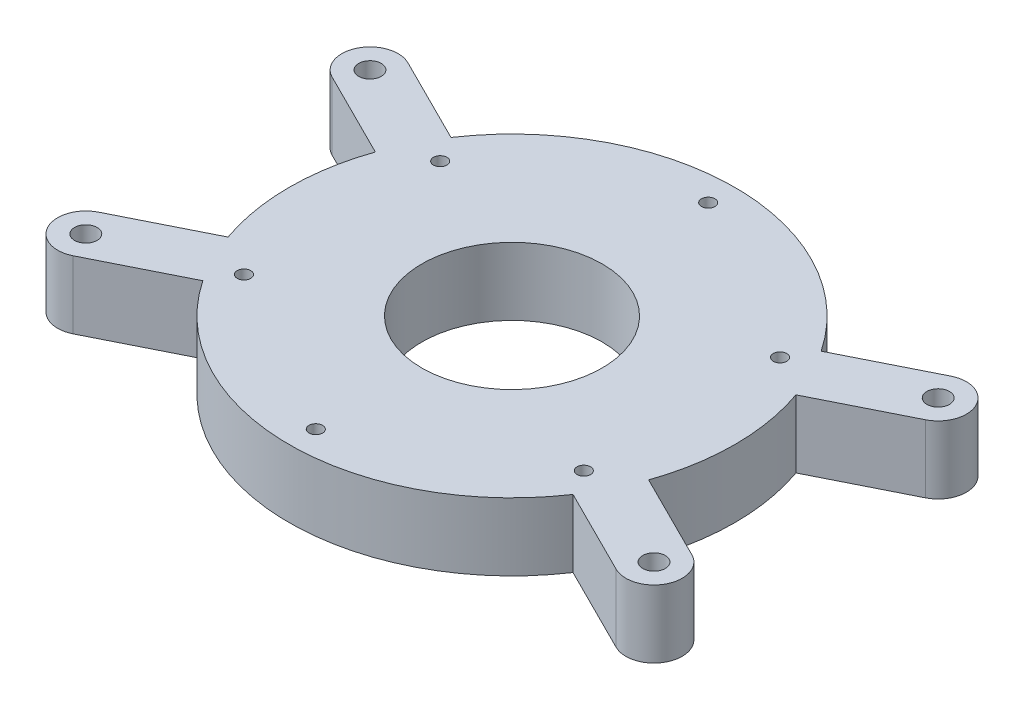
from build123d import *

# Parameters (mm, degrees)
SKETCH_1_R               = 20
EXTRUDE_1_DEPTH          = 15
SKETCH_2_R               = 2.5
CUT_EXTRUDE_1_DEPTH      = 10
MIRROR_2_COPY_1_SKETCH_R = 2.5
MIRROR_2_COPY_1_DEPTH    = 10
SKETCH_3_R               = 2.5
CUT_EXTRUDE_2_DEPTH      = 10
MIRROR_4_COPY_1_SKETCH_R = 2.5
MIRROR_4_COPY_1_DEPTH    = 10
SKETCH_4_R               = 1.5
CUT_EXTRUDE_3_DEPTH      = 87.365727496
PATTERN_CIRCULAR_1_COUNT = 6


with BuildPart() as part:
    # 草图1 → 凸台-拉伸1 (new body)
    with BuildSketch(Plane(origin=(0, 0, 0), x_dir=(1, 0, 0), z_dir=(0, 1, 0))):
        with BuildLine():
            Line((46.623322285, 16.328680875), (65.781966365, 25.910071498))
            ThreePointArc((65.781966365, 25.910071498), (68.576327064, 34.295567803), (60.190830759, 37.089928502))
            Line((60.190830759, 37.089928502), (41.03218668, 27.50853788))
            ThreePointArc((41.03218668, 27.50853788), (0, 49.4), (-41.03218668, 27.50853788))
            Line((-41.03218668, 27.50853788), (-60.190830759, 37.089928502))
            ThreePointArc((-60.190830759, 37.089928502), (-68.576327064, 34.295567803), (-65.781966365, 25.910071498))
            Line((-65.781966365, 25.910071498), (-46.623322285, 16.328680875))
            ThreePointArc((-46.623322285, 16.328680875), (-49.4, 0), (-46.623322285, -16.328680875))
            Line((-46.623322285, -16.328680875), (-65.781966365, -25.910071498))
            ThreePointArc((-65.781966365, -25.910071498), (-68.576327064, -34.295567803), (-60.190830759, -37.089928502))
            Line((-60.190830759, -37.089928502), (-41.03218668, -27.50853788))
            ThreePointArc((-41.03218668, -27.50853788), (0, -49.4), (41.03218668, -27.50853788))
            Line((41.03218668, -27.50853788), (60.190830759, -37.089928502))
            ThreePointArc((60.190830759, -37.089928502), (68.576327064, -34.295567803), (65.781966365, -25.910071498))
            Line((65.781966365, -25.910071498), (46.623322285, -16.328680875))
            ThreePointArc((46.623322285, -16.328680875), (49.4, 0), (46.623322285, 16.328680875))
        make_face()
        with Locations(Location((0, 0, 0), (0, 0, 270))):
            Circle(SKETCH_1_R, mode=Mode.SUBTRACT)
    extrude(amount=EXTRUDE_1_DEPTH)

    # 草图2 → 切除-拉伸1 (cut)
    with BuildSketch(Plane(origin=(0, 15, 0), x_dir=(1, 0, 0), z_dir=(0, 1, 0))):
        with Locations(Location((-62.986398562, 31.5, 0), (0, 0, 270))):
            Circle(SKETCH_2_R)
    cut_extrude_1 = extrude(amount=-CUT_EXTRUDE_1_DEPTH, mode=Mode.SUBTRACT)

    # 镜向1: 切除-拉伸1 across plane
    add(cut_extrude_1.mirror(Plane.XY), mode=Mode.SUBTRACT)

    # 镜向2: 切除-拉伸1 across plane
    add(cut_extrude_1.mirror(Plane(origin=(0, 0, 0), x_dir=(0, 0, 1), z_dir=(1, 0, 0))), mode=Mode.SUBTRACT)

    # 镜向2 copy 1 sketch → 镜向2 copy 1 (cut)
    with BuildSketch(Plane(origin=(0, 15, 0), x_dir=(-1, 0, 0), z_dir=(0, 1, 0))):
        with Locations(Location((-62.986398562, 31.5, 0), (0, 0, 270))):
            Circle(MIRROR_2_COPY_1_SKETCH_R)
    extrude(amount=-MIRROR_2_COPY_1_DEPTH, mode=Mode.SUBTRACT)

    # 草图3 → 切除-拉伸2 (cut)
    with BuildSketch(Plane.XZ):
        with Locations(Location((-54.042512958, 27.027091516, 0), (0, 0, 270))):
            Circle(SKETCH_3_R)
    cut_extrude_2 = extrude(amount=-CUT_EXTRUDE_2_DEPTH, mode=Mode.SUBTRACT)

    # 镜向3: 切除-拉伸2 across plane
    add(cut_extrude_2.mirror(Plane(origin=(0, 0, 0), x_dir=(0, 0, 1), z_dir=(1, 0, 0))), mode=Mode.SUBTRACT)

    # 镜向4: 切除-拉伸2 across plane
    add(cut_extrude_2.mirror(Plane.XY), mode=Mode.SUBTRACT)

    # 镜向4 copy 1 sketch → 镜向4 copy 1 (cut)
    with BuildSketch(Plane(origin=(0, 0, 0), x_dir=(-1, 0, 0), z_dir=(0, -1, 0))):
        with Locations(Location((-54.042512958, 27.027091516, 0), (0, 0, 270))):
            Circle(MIRROR_4_COPY_1_SKETCH_R)
    extrude(amount=-MIRROR_4_COPY_1_DEPTH, mode=Mode.SUBTRACT)

    # 草图4 → 切除-拉伸3 (cut, through all)
    with BuildSketch(Plane.XZ):
        with Locations(Location((0, -43.5, 0), (0, 0, 270))):
            Circle(SKETCH_4_R)
    cut_extrude_3 = extrude(amount=-CUT_EXTRUDE_3_DEPTH, mode=Mode.SUBTRACT)

    # 阵列(圆周)1: 切除-拉伸3 ×6 about axis
    pattern_circular_1_axis = Axis((0, 0, 0), (0, 1, 0))
    for i in range(1, PATTERN_CIRCULAR_1_COUNT):
        add(cut_extrude_3.rotate(pattern_circular_1_axis, i * 360 / PATTERN_CIRCULAR_1_COUNT), mode=Mode.SUBTRACT)


solid = part.part
